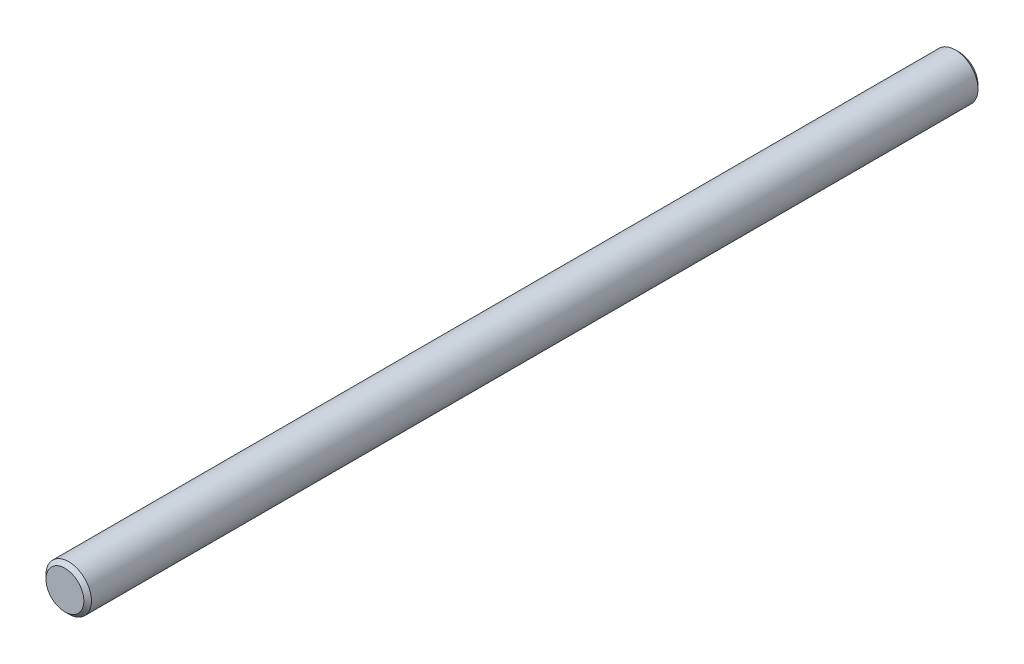
from build123d import *

# Parameters (mm, degrees)
SKETCH1_R           = 3
BOSS_EXTRUDE1_DEPTH = 118
CHAMFER1_SIZE       = 0.5


with BuildPart() as part:
    # Sketch1 → Boss-Extrude1 (new body)
    with BuildSketch(Plane.XY):
        Circle(SKETCH1_R)
    extrude(amount=BOSS_EXTRUDE1_DEPTH)

    # Chamfer1
    chamfer1_edges = [part.edges().sort_by_distance(p)[0] for p in [
        (-3, 0, 0),
        (-3, 0, 118),
    ]]
    chamfer(chamfer1_edges, length=CHAMFER1_SIZE)


solid = part.part
